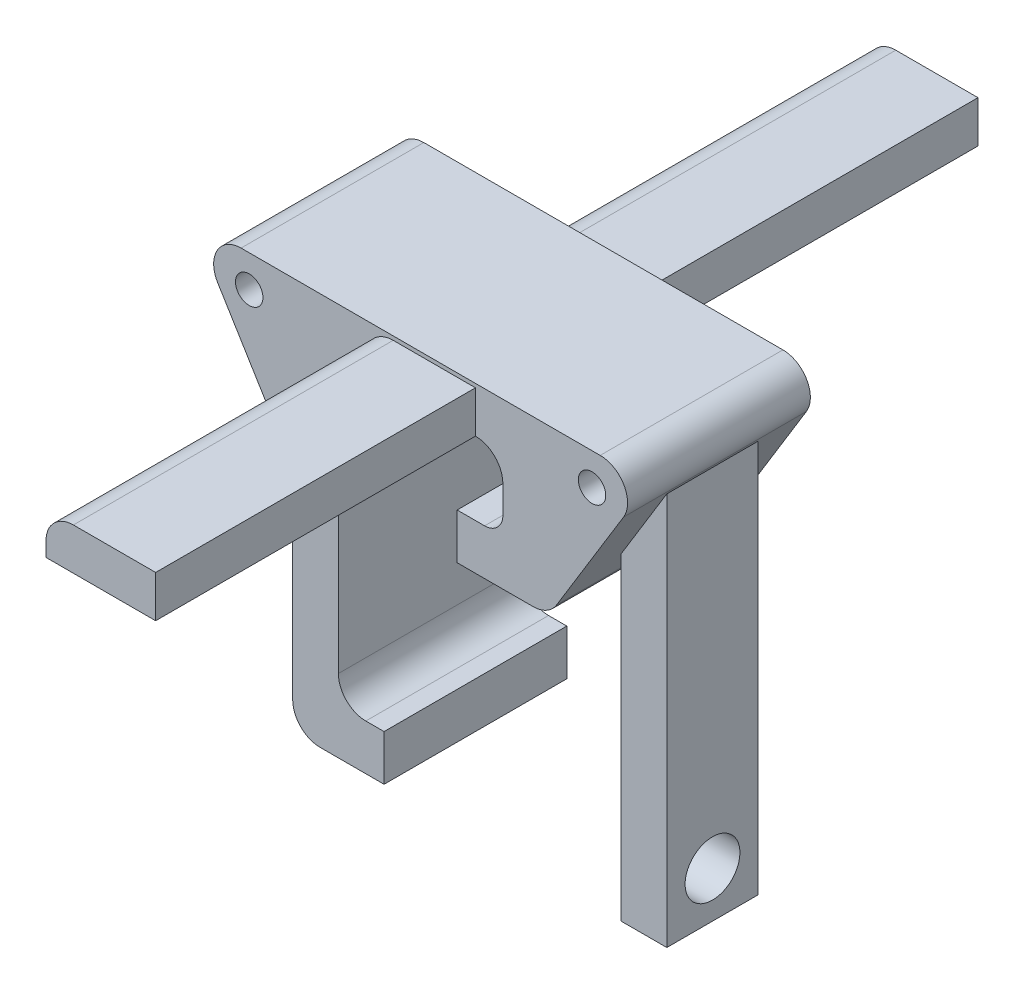
from build123d import *

# Parameters (mm, degrees)
EXTRUDE_THIN1_DEPTH = 20
BOSS_EXTRUDE1_DEPTH = 20
FILLET1_R           = 3
CUT_EXTRUDE1_REACH  = 55.346
SKETCH4_R           = 1.5
FILLET2_R           = 3
FILLET3_R           = 2
SKETCH5_W           = 12
SKETCH5_H           = 4.580516002
BOSS_EXTRUDE2_DEPTH = 35
BOSS_EXTRUDE3_START = -55
SKETCH5_2_W         = 12
SKETCH5_2_H         = 4.580516002
BOSS_EXTRUDE3_DEPTH = 35
FILLET4_R           = 3
BOSS_EXTRUDE4_START = -5
SKETCH6_W           = 5
SKETCH6_H           = 43
BOSS_EXTRUDE4_DEPTH = 10
SKETCH7_R           = 3
CUT_EXTRUDE2_DEPTH  = 5


with BuildPart() as part:
    # Sketch2 → Extrude-Thin1 (new body)
    with BuildSketch(Plane.XY):
        Polygon((-13, -33), (-18, -33), (-18, 0), (0, 0), (0, -8), (-5, -8), (-5, -13), (5, -13), (5, 5), (-23, 5), (-23, -38), (-13, -38), align=None)
    extrude(amount=EXTRUDE_THIN1_DEPTH)

    # Sketch3 → Boss-Extrude1 (add)
    with BuildSketch(Plane.XY.offset(20)):
        Polygon((5, 5), (16, 5), (5, -13), align=None)
        Polygon((-23, 5), (-34, 5), (-23, -13), align=None)
    extrude(amount=-BOSS_EXTRUDE1_DEPTH)

    # Fillet1
    fillet1_edges = [part.edges().sort_by_distance(p)[0] for p in [
        (-23, -38, 10),
        (5, -13, 10),
        (-18, -33, 10),
        (16, 5, 10),
        (-34, 5, 10),
        (-23, -13, 10),
    ]]
    fillet(fillet1_edges, radius=FILLET1_R)

    # Sketch4 → Cut-Extrude1 (cut, up to next)
    with BuildSketch(Plane.XY.offset(20), mode=Mode.PRIVATE) as cut_extrude1_sk1:
        with Locations((9.759301062, 1.5)):
            Circle(SKETCH4_R)
    cut_extrude1_tool1 = extrude(cut_extrude1_sk1.sketch, amount=-CUT_EXTRUDE1_REACH, mode=Mode.PRIVATE) & part.part
    # Sketch4 → Cut-Extrude1 (cut, up to next)
    with BuildSketch(Plane.XY.offset(20), mode=Mode.PRIVATE) as cut_extrude1_sk2:
        with Locations((-27.759301062, 1.5)):
            Circle(SKETCH4_R)
    cut_extrude1_tool2 = extrude(cut_extrude1_sk2.sketch, amount=-CUT_EXTRUDE1_REACH, mode=Mode.PRIVATE) & part.part
    add(cut_extrude1_tool1.solids().sort_by_distance((9.759301, 1.5, 20))[0], mode=Mode.SUBTRACT)
    add(cut_extrude1_tool2.solids().sort_by_distance((-27.759301, 1.5, 20))[0], mode=Mode.SUBTRACT)

    # Fillet2
    fillet2_edges = [part.edges().sort_by_distance(p)[0] for p in [
        (0, 0, 10),
        (-18, 0, 10),
    ]]
    fillet(fillet2_edges, radius=FILLET2_R)

    # Fillet3
    fillet3_edges = [part.edges().sort_by_distance(p)[0] for p in [
        (0, -8, 10),
    ]]
    fillet(fillet3_edges, radius=FILLET3_R)

    # Sketch5 → Boss-Extrude2 (add)
    with BuildSketch(Plane.XY.offset(20)):
        with Locations((-9, 2.290258001)):
            Rectangle(SKETCH5_W, SKETCH5_H)
    extrude(amount=BOSS_EXTRUDE2_DEPTH)

    # Sketch5<2> → Boss-Extrude3 (add)
    with BuildSketch(Plane.XY.offset(20).offset(BOSS_EXTRUDE3_START)):
        with Locations((-9, 2.290258001)):
            Rectangle(SKETCH5_2_W, SKETCH5_2_H)
    extrude(amount=BOSS_EXTRUDE3_DEPTH)

    # Fillet4
    fillet4_edges = [part.edges().sort_by_distance(p)[0] for p in [
        (-15, 4.580516002, 37.5),
        (-15, 4.580516002, -17.5),
    ]]
    fillet(fillet4_edges, radius=FILLET4_R)

    # Sketch6 → Boss-Extrude4 (add)
    with BuildSketch(Plane.XY.offset(20).offset(BOSS_EXTRUDE4_START)):
        with Locations((10.444444444, -21.5)):
            Rectangle(SKETCH6_W, SKETCH6_H)
    extrude(amount=-BOSS_EXTRUDE4_DEPTH)

    # Sketch7 → Cut-Extrude2 (cut)
    with BuildSketch(Plane(origin=(12.944444444, 0, 0), x_dir=(0, 0, -1), z_dir=(1, 0, 0))):
        with Locations(Location((-10, -38, 0), (0, 0, 90))):
            Circle(SKETCH7_R)
    extrude(amount=-CUT_EXTRUDE2_DEPTH, mode=Mode.SUBTRACT)


solid = part.part
